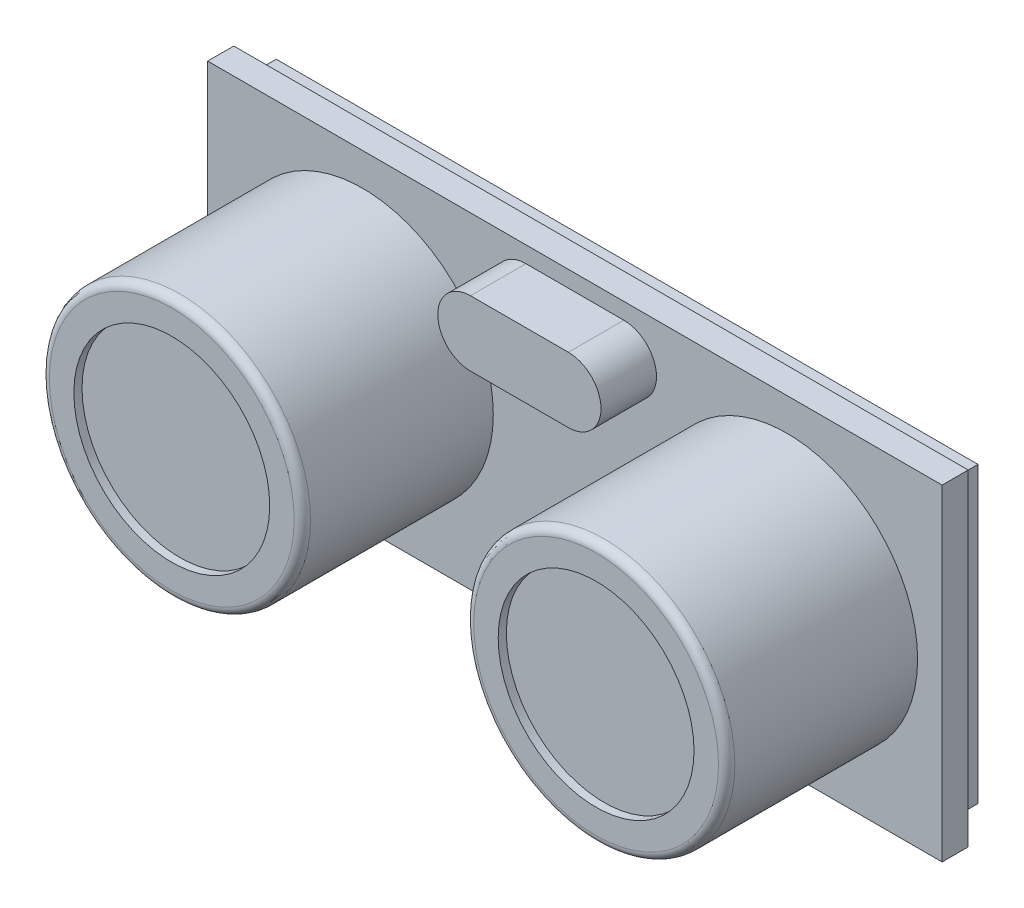
from build123d import *

# Parameters (mm, degrees)
SKETCH_1_W          = 45
SKETCH_1_H          = 20
EXTRUDE_1_DEPTH     = 1.6
SKETCH_2_R          = 8
EXTRUDE_2_DEPTH     = 11.7
FILLET_1_R          = 0.5
SKETCH_3_R          = 6
CUT_EXTRUDE_1_DEPTH = 0.5
EXTRUDE_3_DEPTH     = 3.4
SKETCH_5_W          = 10
SKETCH_5_H          = 2.5
EXTRUDE_4_DEPTH     = 2
EXTRUDE_5_DEPTH     = 1.6


with BuildPart() as part:
    # Эскиз1 → Бобышка-Вытянуть1 (new body)
    with BuildSketch(Plane.XY):
        Rectangle(SKETCH_1_W, SKETCH_1_H)
    extrude(amount=EXTRUDE_1_DEPTH)

    # Эскиз2 → Бобышка-Вытянуть2 (add)
    with BuildSketch(Plane.XY.offset(1.6)):
        with Locations(Location((-13, 0, 0), (0, 0, 180))):
            Circle(SKETCH_2_R)
        with Locations(Location((13, 0, 0), (0, 0, 180))):
            Circle(SKETCH_2_R)
    extrude(amount=EXTRUDE_2_DEPTH)

    # Скругление1
    fillet_1_edges = [part.edges().sort_by_distance(p)[0] for p in [
        (-5, 0, 13.3),
        (21, 0, 13.3),
    ]]
    fillet(fillet_1_edges, radius=FILLET_1_R)

    # Эскиз3 → Вырез-Вытянуть1 (cut)
    with BuildSketch(Plane.XY.offset(13.3)):
        with Locations((-13, 0)):
            Circle(SKETCH_3_R)
        with Locations((13, 0)):
            Circle(SKETCH_3_R)
    extrude(amount=-CUT_EXTRUDE_1_DEPTH, mode=Mode.SUBTRACT)

    # Эскиз4 → Бобышка-Вытянуть3 (add)
    with BuildSketch(Plane.XY.offset(1.6)):
        with BuildLine():
            Line((-3, 9), (3, 9))
            ThreePointArc((3, 9), (5, 7), (3, 5))
            Line((3, 5), (-3, 5))
            ThreePointArc((-3, 5), (-5, 7), (-3, 9))
        make_face()
    extrude(amount=EXTRUDE_3_DEPTH)

    # Эскиз5 → Бобышка-Вытянуть4 (add)
    with BuildSketch(Plane(origin=(0, 0, 0), x_dir=(-1, 0, 0), z_dir=(0, 0, -1))):
        with Locations((0, -7.75)):
            Rectangle(SKETCH_5_W, SKETCH_5_H)
    extrude(amount=EXTRUDE_4_DEPTH)

    # Эскиз8 → Бобышка-Вытянуть5 (add)
    with BuildSketch(Plane(origin=(0, 0, 0), x_dir=(-1, 0, 0), z_dir=(0, 0, -1))):
        Polygon((-6, -9), (-6, -5.5), (6, -5.5), (6, -9), (21.5, -9), (21.5, 9), (-21.5, 9), (-21.5, -9), align=None)
    extrude(amount=EXTRUDE_5_DEPTH)


solid = part.part
